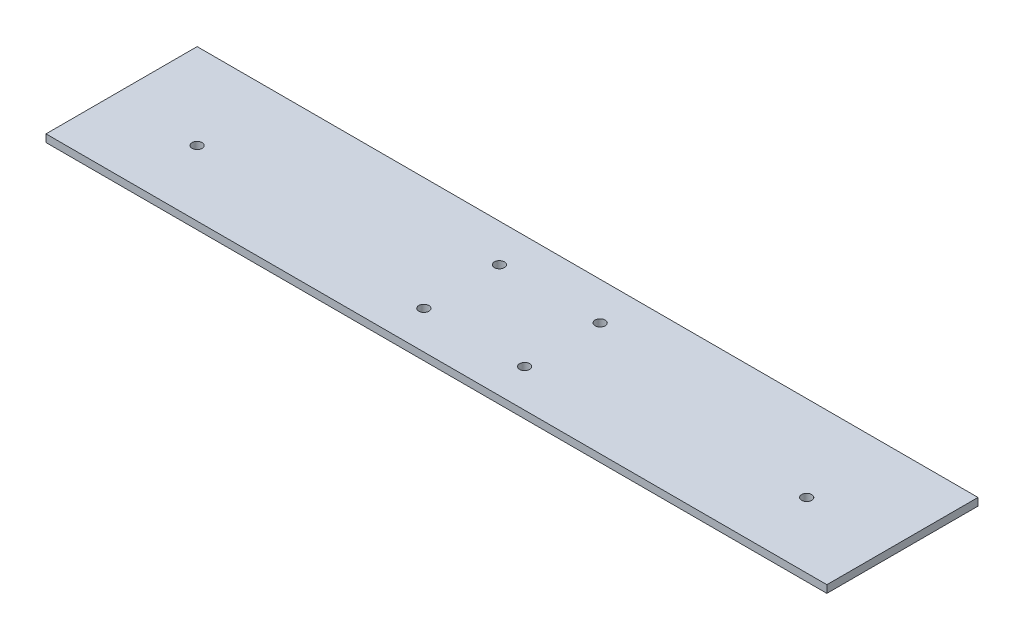
from build123d import *

# Parameters (mm, degrees)
SKETCH1_W           = 310
SKETCH1_H           = 60
BOSS_EXTRUDE1_DEPTH = 3
OTW_R_POD_RUB_M41_D = 4


with BuildPart() as part:
    # Sketch1 → Boss-Extrude1 (new body)
    with BuildSketch(Plane(origin=(0, 0, 0), x_dir=(1, 0, 0), z_dir=(0, 1, 0))):
        with Locations((145, 30)):
            Rectangle(SKETCH1_W, SKETCH1_H)
    extrude(amount=BOSS_EXTRUDE1_DEPTH)

    # Otwór pod śrubę M41 (through all)
    with Locations(Plane(origin=(0, 3, 0), x_dir=(1, 0, 0), z_dir=(0, 1, 0))):
        with Locations((266, 26), (24, 26), (125, 15), (165, 15), (165, 45), (125, 45)):
            Hole(OTW_R_POD_RUB_M41_D / 2)


solid = part.part
